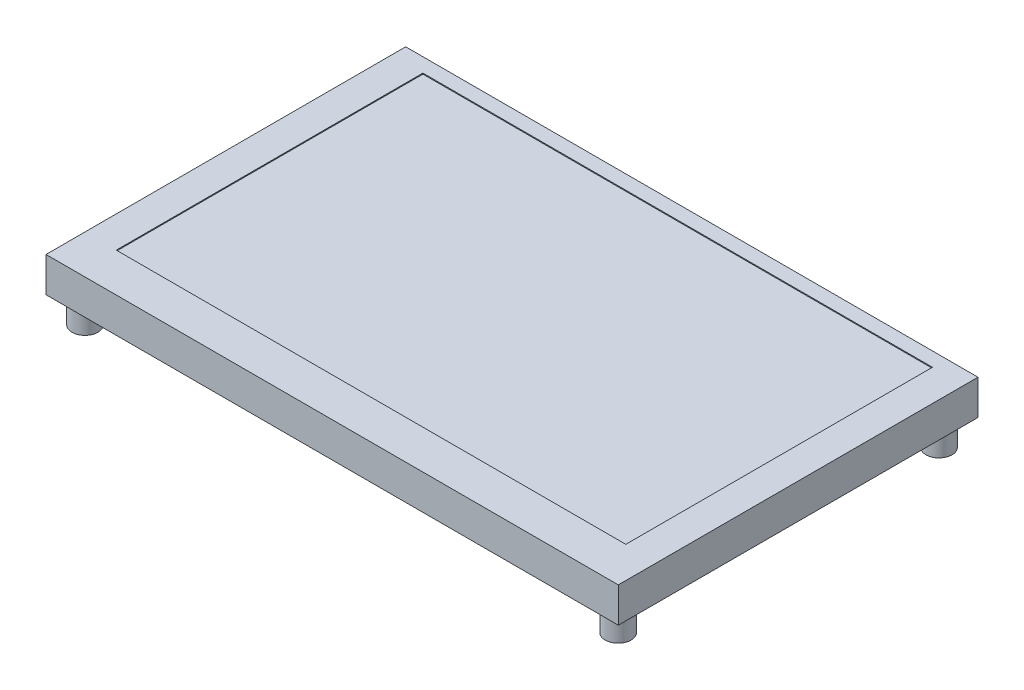
from build123d import *

# Parameters (mm, degrees)
SKETCH1_W           = 121.3
SKETCH1_H           = 76.24
BOSS_EXTRUDE1_DEPTH = 7.4
SKETCH2_R           = 2.75
SKETCH2_R_2         = 1.5
BOSS_EXTRUDE2_DEPTH = 5.5
SKETCH3_R           = 2.75
SKETCH3_R_2         = 1.5
BOSS_EXTRUDE3_DEPTH = 5.3
SKETCH4_W           = 108
SKETCH4_H           = 65
CUT_EXTRUDE1_DEPTH  = 0.2
SKETCH5_R           = 8
BOSS_EXTRUDE4_DEPTH = 4
SKETCH6_W           = 5
SKETCH6_H           = 22
BOSS_EXTRUDE5_DEPTH = 3


with BuildPart() as part:
    # Sketch1 → Boss-Extrude1 (new body)
    with BuildSketch(Plane(origin=(0, 0, 0), x_dir=(1, 0, 0), z_dir=(0, 1, 0))):
        Rectangle(SKETCH1_W, SKETCH1_H)
    extrude(amount=BOSS_EXTRUDE1_DEPTH)

    # Sketch2 → Boss-Extrude2 (add)
    # profile 1 of 4: a face of its own
    with BuildSketch(Plane.XZ):
        with Locations(Location((-56.5, 34, 0), (0, 0, 270))):
            Circle(SKETCH2_R)
        with Locations(Location((-56.5, 34, 0), (0, 0, 270))):
            Circle(SKETCH2_R_2, mode=Mode.SUBTRACT)
    # profile 2 of 4: a face of its own
    with BuildSketch(Plane.XZ):
        with Locations(Location((56.5, 34, 0), (0, 0, 270))):
            Circle(SKETCH2_R)
        with Locations(Location((56.5, 34, 0), (0, 0, 270))):
            Circle(SKETCH2_R_2, mode=Mode.SUBTRACT)
    # profile 3 of 4: a face of its own
    with BuildSketch(Plane.XZ):
        with Locations(Location((56.5, -34, 0), (0, 0, 270))):
            Circle(SKETCH2_R)
        with Locations(Location((56.5, -34, 0), (0, 0, 270))):
            Circle(SKETCH2_R_2, mode=Mode.SUBTRACT)
    # profile 4 of 4: a face of its own
    with BuildSketch(Plane.XZ):
        with Locations(Location((-56.5, -34, 0), (0, 0, 270))):
            Circle(SKETCH2_R)
        with Locations(Location((-56.5, -34, 0), (0, 0, 270))):
            Circle(SKETCH2_R_2, mode=Mode.SUBTRACT)
    extrude(amount=BOSS_EXTRUDE2_DEPTH)

    # Sketch3 → Boss-Extrude3 (add)
    # profile 1 of 4: a face of its own
    with BuildSketch(Plane.XZ):
        with Locations(Location((-29.35, 24.62, 0), (0, 0, 270))):
            Circle(SKETCH3_R)
        with Locations(Location((-29.35, 24.62, 0), (0, 0, 270))):
            Circle(SKETCH3_R_2, mode=Mode.SUBTRACT)
    # profile 2 of 4: a face of its own
    with BuildSketch(Plane.XZ):
        with Locations(Location((28.65, 24.62, 0), (0, 0, 270))):
            Circle(SKETCH3_R)
        with Locations(Location((28.65, 24.62, 0), (0, 0, 270))):
            Circle(SKETCH3_R_2, mode=Mode.SUBTRACT)
    # profile 3 of 4: a face of its own
    with BuildSketch(Plane.XZ):
        with Locations(Location((28.65, -24.38, 0), (0, 0, 270))):
            Circle(SKETCH3_R)
        with Locations(Location((28.65, -24.38, 0), (0, 0, 270))):
            Circle(SKETCH3_R_2, mode=Mode.SUBTRACT)
    # profile 4 of 4: a face of its own
    with BuildSketch(Plane.XZ):
        with Locations(Location((-29.35, -24.38, 0), (0, 0, 270))):
            Circle(SKETCH3_R)
        with Locations(Location((-29.35, -24.38, 0), (0, 0, 270))):
            Circle(SKETCH3_R_2, mode=Mode.SUBTRACT)
    extrude(amount=BOSS_EXTRUDE3_DEPTH)

    # Sketch4 → Cut-Extrude1 (cut)
    with BuildSketch(Plane(origin=(0, 7.4, 0), x_dir=(1, 0, 0), z_dir=(0, 1, 0))):
        with Locations((0, 2.62)):
            Rectangle(SKETCH4_W, SKETCH4_H)
    extrude(amount=-CUT_EXTRUDE1_DEPTH, mode=Mode.SUBTRACT)

    # Sketch5 → Boss-Extrude4 (add)
    with BuildSketch(Plane(origin=(0, 0, 0), x_dir=(-1, 0, 0), z_dir=(0, -1, 0))):
        with Locations(Location((43.65, 30.12, 0), (0, 0, 90))):
            Circle(SKETCH5_R)
    extrude(amount=BOSS_EXTRUDE4_DEPTH)

    # Sketch6 → Boss-Extrude5 (add)
    with BuildSketch(Plane.XZ):
        with Locations((-45.15, -3.52)):
            Rectangle(SKETCH6_W, SKETCH6_H)
    extrude(amount=BOSS_EXTRUDE5_DEPTH)


solid = part.part
